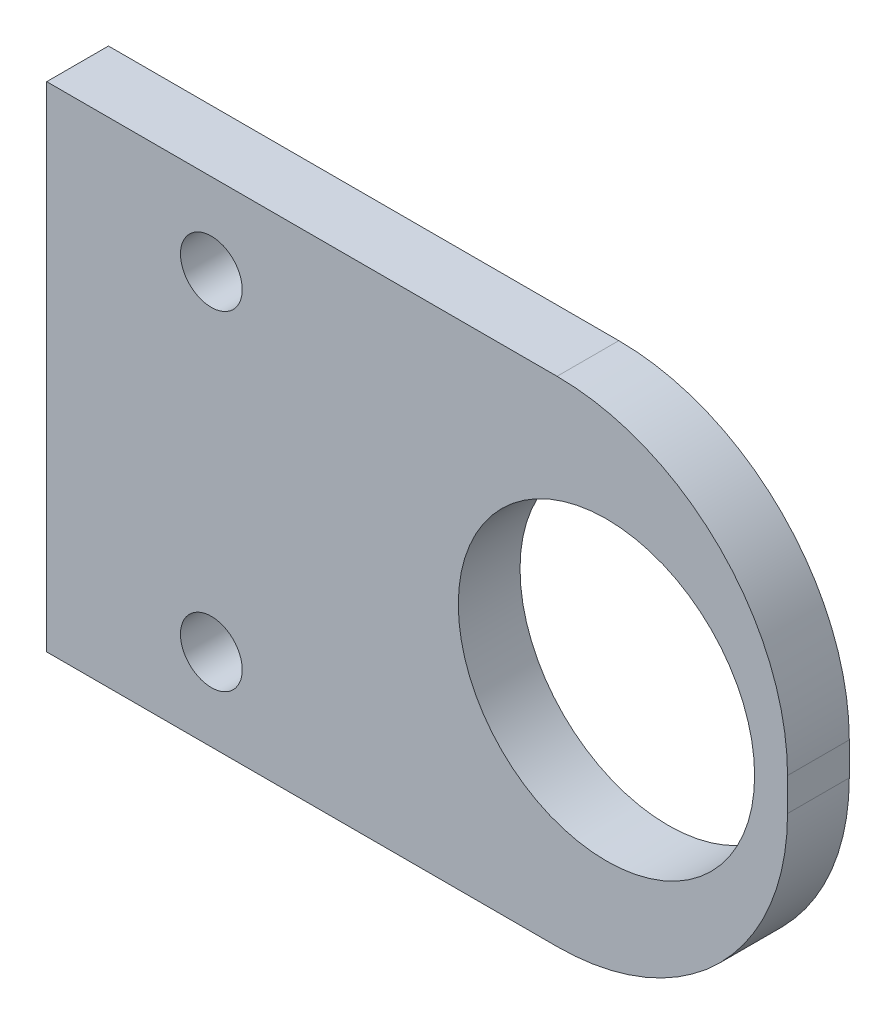
from build123d import *

# Parameters (mm, degrees)
SKETCH1_R           = 11.43
SKETCH1_R_2         = 2.38125
BOSS_EXTRUDE1_DEPTH = 4.7625


with BuildPart() as part:
    # Sketch1 → Boss-Extrude1 (new body)
    with BuildSketch(Plane.XY):
        with BuildLine():
            Line((-28.575, 19.05), (10.795, 19.05))
            ThreePointArc((10.795, 19.05), (23.367358569, 13.842358569), (28.575, 1.27))
            Line((28.575, 1.27), (28.575, -1.27))
            ThreePointArc((28.575, -1.27), (23.367358569, -13.842358569), (10.795, -19.05))
            Line((10.795, -19.05), (-28.575, -19.05))
            Line((-28.575, -19.05), (-28.575, 19.05))
        make_face()
        with Locations(Location((14.605, 0, 0), (0, 0, 180))):
            Circle(SKETCH1_R, mode=Mode.SUBTRACT)
        with Locations(Location((-15.875, 12.7, 0), (0, 0, 180))):
            Circle(SKETCH1_R_2, mode=Mode.SUBTRACT)
        with Locations(Location((-15.875, -12.7, 0), (0, 0, 180))):
            Circle(SKETCH1_R_2, mode=Mode.SUBTRACT)
    extrude(amount=BOSS_EXTRUDE1_DEPTH)


solid = part.part
